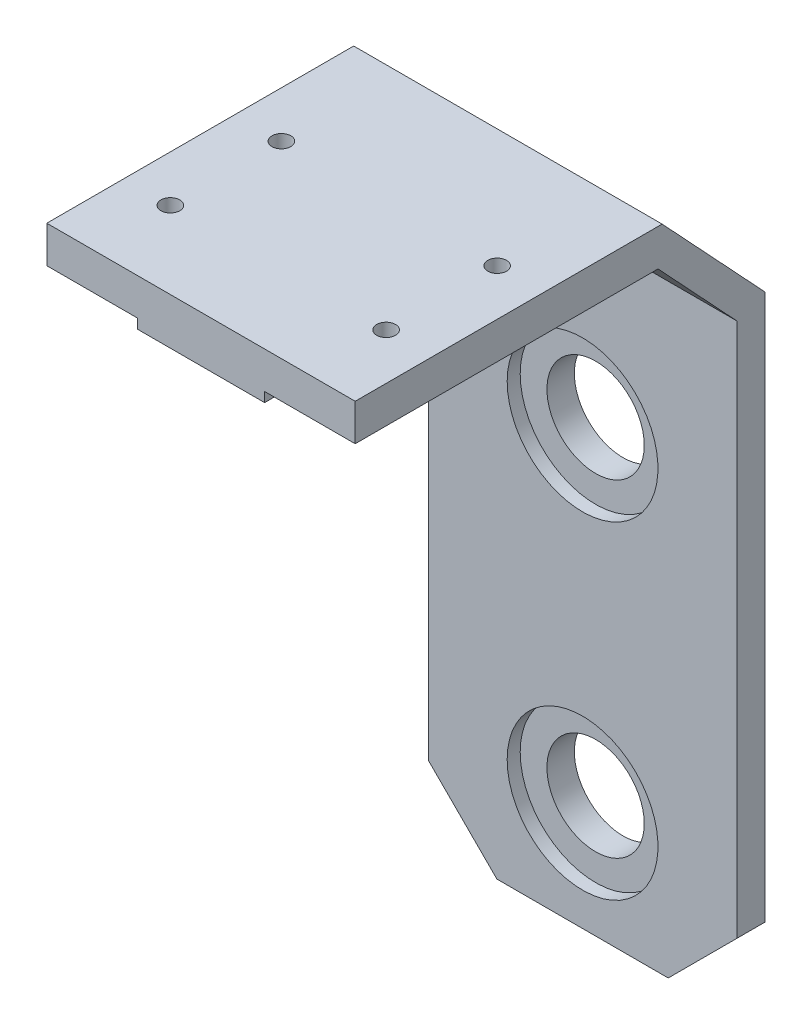
from build123d import *

# Parameters (mm, degrees)
SKETCH1_W                       = 45
SKETCH1_H                       = 86
SKETCH1_R                       = 7.1
BOSS_EXTRUDE1_DEPTH             = 4
BOSS_EXTRUDE2_DEPTH             = 45
SKETCH3_W                       = 45
SKETCH3_H                       = 5.372111066
BOSS_EXTRUDE3_DEPTH             = 40
BOSS_EXTRUDE3_DIRECTION_2_REACH = 70.185
SKETCH4_W                       = 45
SKETCH4_H                       = 5.372111066
BOSS_EXTRUDE4_DEPTH             = 3.295
SKETCH5_W                       = 18.57978737
SKETCH5_H                       = 1.409707481
BOSS_EXTRUDE5_DEPTH             = 44.189029
CHAMFER2_SIZE                   = 1.405
BOSS_EXTRUDE7_DEPTH             = 45
SKETCH8_R                       = 1.375
CUT_EXTRUDE1_DEPTH              = 125.392527932
CHAMFER3_SIZE                   = 10
CHAMFER4_SIZE                   = 1.75
SKETCH9_R                       = 11
SKETCH9_W                       = 45
SKETCH9_H                       = 4.475285766
BOSS_EXTRUDE8_DEPTH             = 1.9


with BuildPart() as part:
    # Sketch1 → Boss-Extrude1 (new body)
    with BuildSketch(Plane.XY):
        with Locations((0, -1)):
            Rectangle(SKETCH1_W, SKETCH1_H)
        with Locations((0, 19.65)):
            Circle(SKETCH1_R, mode=Mode.SUBTRACT)
        with Locations((0, -28.15)):
            Circle(SKETCH1_R, mode=Mode.SUBTRACT)
    extrude(amount=BOSS_EXTRUDE1_DEPTH)

    # Sketch2 → Boss-Extrude2 (add)
    with BuildSketch(Plane(origin=(22.5, 0, 0), x_dir=(0, 0, -1), z_dir=(1, 0, 0))):
        with BuildLine():
            Line((-4, 42), (-17.385970531, 56.343405204))
            add(Edge.make_bspline(
                [(-18.399488548, 61.71551627), (-17.964102111, 59.93301782), (-17.698797731, 58.135329436), (-17.385970531, 56.343405204)],
                knots=[0.068292811, 0.068292811, 0.068292811, 0.068292811, 0.115576408, 0.115576408, 0.115576408, 0.115576408], degree=3))
            Line((-18.399488548, 61.71551627), (0, 42))
            Line((0, 42), (-4, 42))
        make_face()
    extrude(amount=-BOSS_EXTRUDE2_DEPTH)

    # Sketch3 → Boss-Extrude3 (add)
    with BuildSketch(Plane.XY.offset(18.28)):
        with Locations((0, 59.029460737)):
            Rectangle(SKETCH3_W, SKETCH3_H)
    extrude(amount=BOSS_EXTRUDE3_DEPTH)

    # Sketch3 → Boss-Extrude3 direction 2 (add, up to next)
    with BuildSketch(Plane.XY.offset(18.28), mode=Mode.PRIVATE) as boss_extrude3_direction_2_sk1:
        with Locations((0, 59.029460737)):
            Rectangle(SKETCH3_W, SKETCH3_H)
    boss_extrude3_direction_2_tool1 = extrude(boss_extrude3_direction_2_sk1.sketch, amount=-BOSS_EXTRUDE3_DIRECTION_2_REACH, mode=Mode.PRIVATE) - part.part
    add(boss_extrude3_direction_2_tool1.solids().sort_by_distance((0, 59.029461, 18.28))[0])

    # Sketch4 → Boss-Extrude4 (add)
    with BuildSketch(Plane.XY.offset(58.28)):
        with Locations((0, 59.029460737)):
            Rectangle(SKETCH4_W, SKETCH4_H)
    extrude(amount=BOSS_EXTRUDE4_DEPTH)

    # Sketch5 → Boss-Extrude5 (add)
    with BuildSketch(Plane.XY.offset(61.575)):
        with Locations((-0.00312038, 55.638551464)):
            Rectangle(SKETCH5_W, SKETCH5_H)
    extrude(amount=-BOSS_EXTRUDE5_DEPTH)

    # Chamfer2
    chamfer2_edges = [part.edges().sort_by_distance(p)[0] for p in [
        (-0.00312038, 54.933697723, 17.385971),
    ]]
    chamfer(chamfer2_edges, length=CHAMFER2_SIZE)

    # Sketch7 → Boss-Extrude7 (add)
    with BuildSketch(Plane(origin=(22.5, 0, 0), x_dir=(0, 0, -1), z_dir=(1, 0, 0))):
        Polygon((-18.28, 61.71551627), (-16.793697174, 61.71551627), (0, 43.720645978), (0, 42), (-18.28, 61.587481275), align=None)
    extrude(amount=-BOSS_EXTRUDE7_DEPTH)

    # Sketch8 → Cut-Extrude1 (cut, through all)
    with BuildSketch(Plane(origin=(0, 61.71551627, 0), x_dir=(1, 0, 0), z_dir=(0, 1, 0))):
        with Locations(Location((15.735, -50.299042534, 0), (0, 0, 180))):
            Circle(SKETCH8_R)
        with Locations(Location((15.735, -34.097127603, 0), (0, 0, 180))):
            Circle(SKETCH8_R)
        with Locations(Location((-15.743014065, -34.097127603, 0), (0, 0, 180))):
            Circle(SKETCH8_R)
        with Locations(Location((-15.743014065, -50.299042534, 0), (0, 0, 180))):
            Circle(SKETCH8_R)
    extrude(amount=-CUT_EXTRUDE1_DEPTH, mode=Mode.SUBTRACT)

    # Chamfer3
    chamfer3_edges = [part.edges().sort_by_distance(p)[0] for p in [
        (22.5, -44, 2),
        (-22.5, -44, 2),
    ]]
    chamfer(chamfer3_edges, length=CHAMFER3_SIZE)

    # Chamfer4
    chamfer4_edges = [part.edges().sort_by_distance(p)[0] for p in [
        (22.5, 4.860322989, 0),
        (0, -44, 0),
        (-17.5, -39, 0),
        (17.5, -39, 0),
        (-22.5, 4.860322989, 0),
    ]]
    chamfer(chamfer4_edges, length=CHAMFER4_SIZE)

    # Sketch9 → Boss-Extrude8 (add)
    # profile 1 of 2: a face of its own
    with BuildSketch(Plane.XY.offset(4)):
        Polygon((-22.5, -34), (-12.5, -44), (12.5, -44), (22.5, -34), (22.5, 42), (-22.5, 42), align=None)
        with Locations(Location((0, -28.15, 0), (0, 0, 180))):
            Circle(SKETCH9_R, mode=Mode.SUBTRACT)
        with Locations(Location((0, 19.65, 0), (0, 0, 180))):
            Circle(SKETCH9_R, mode=Mode.SUBTRACT)
    # profile 2 of 2: a face of its own
    with BuildSketch(Plane.XY.offset(4)):
        with Locations((0, 44.237642883)):
            Rectangle(SKETCH9_W, SKETCH9_H)
    extrude(amount=BOSS_EXTRUDE8_DEPTH)


solid = part.part
